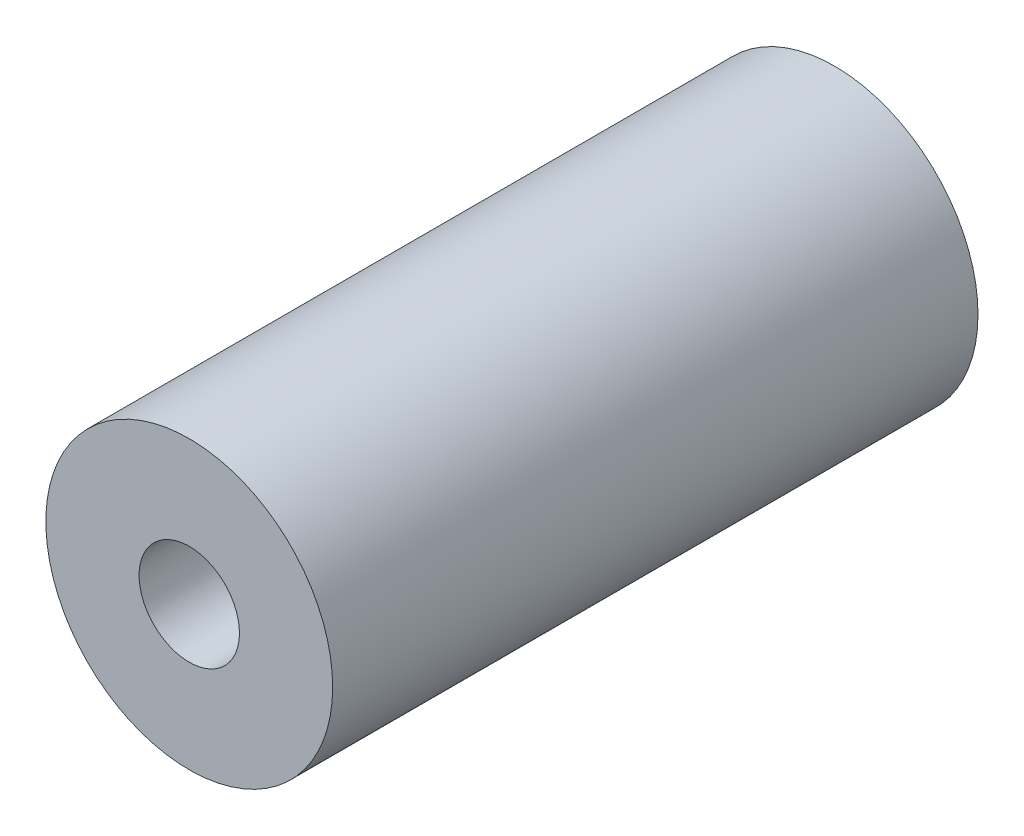
from build123d import *

# Parameters (mm, degrees)
SKETCH1_R           = 4
BOSS_EXTRUDE1_DEPTH = 18
SKETCH2_R           = 1.4
CUT_EXTRUDE1_DEPTH  = 19.867962264


with BuildPart() as part:
    # Sketch1 → Boss-Extrude1 (new body)
    with BuildSketch(Plane.XY):
        Circle(SKETCH1_R)
    extrude(amount=BOSS_EXTRUDE1_DEPTH)

    # Sketch2 → Cut-Extrude1 (cut, through all)
    with BuildSketch(Plane.XY.offset(18)):
        Circle(SKETCH2_R)
    extrude(amount=-CUT_EXTRUDE1_DEPTH, mode=Mode.SUBTRACT)


solid = part.part
